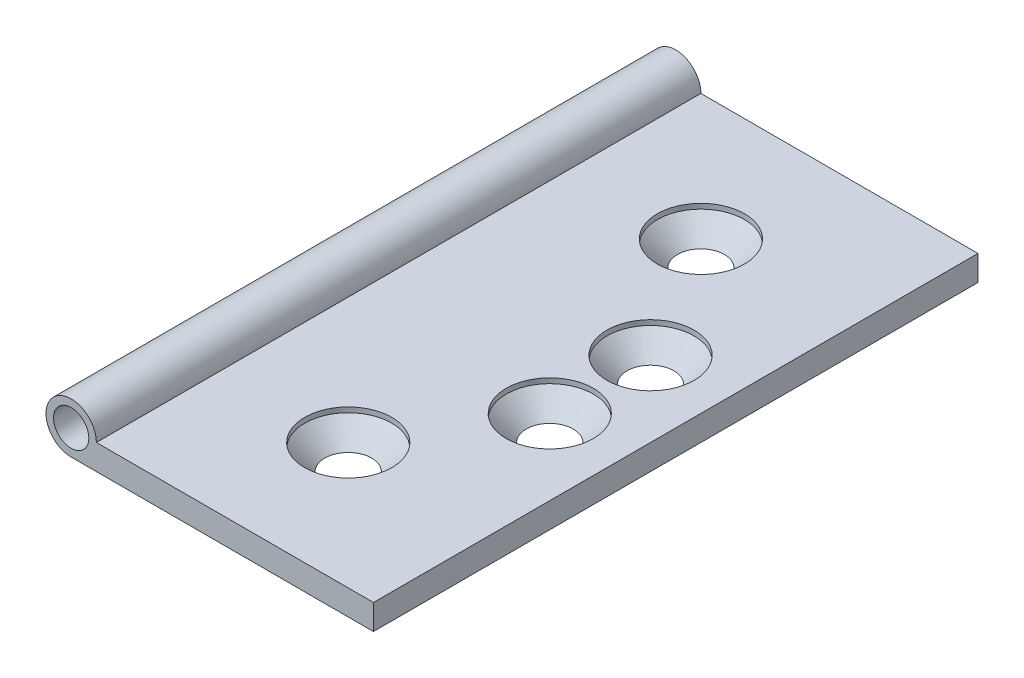
from build123d import *

# Parameters (mm, degrees)
SKETCH_1_W                 = 60
SKETCH_1_H                 = 5
EXTRUDE_1_DEPTH            = 60
SKETCH_3_R                 = 5
EXTRUDE_1_2_DEPTH          = 120
SKETCH_4_R                 = 3.5
CUT_EXTRUDE_1_DEPTH        = 120
HOLE_WIZARD_M81_AT_2_COUNT = 2
HOLE_WIZARD_M81_AT_2_PITCH = 29.154759474


with BuildPart() as part:
    # Эскиз1 → Extrude 1 (new, symmetric)
    with BuildSketch(Plane.XY):
        with Locations((30, -2.5)):
            Rectangle(SKETCH_1_W, SKETCH_1_H)
    extrude(amount=EXTRUDE_1_DEPTH, both=True)

    # Эскиз3 → Extrude 1 2 (add)
    with BuildSketch(Plane.XY.offset(60)):
        Circle(SKETCH_3_R)
    extrude(amount=-EXTRUDE_1_2_DEPTH)

    # Эскиз4 → Вырез-Вытянуть1 (cut)
    with BuildSketch(Plane.XY.offset(60)):
        Circle(SKETCH_4_R)
    extrude(amount=-CUT_EXTRUDE_1_DEPTH, mode=Mode.SUBTRACT)

    # Эскиз6 → Зенковка для  винта с полупотайной головкой M81 (revolve, cut)
    with BuildSketch(Plane(origin=(30, 0, 35), x_dir=(0, 0, 1), z_dir=(1, 0, 0))):
        Polygon((0, 0), (0, 5), (4.5, 5), (4.5, 5.15), (8.65, 1), (8.65, 0), align=None)
    hole_wizard_m81 = revolve(axis=Axis((30, 6.35, 35), (0, -1, 0)), mode=Mode.SUBTRACT)

    # Зенковка для  винта с полупотайной головкой M81 at 2: Зенковка для  винта с полупотайной головкой M81 ×2
    with Locations(*[Vector(0.5144957554275266, 0, -0.8574929257125442) * (i * HOLE_WIZARD_M81_AT_2_PITCH) for i in range(1, HOLE_WIZARD_M81_AT_2_COUNT)]):
        add(hole_wizard_m81, mode=Mode.SUBTRACT)

    # Зеркальное отражение2: Зенковка для  винта с полупотайной головкой M81 across plane
    add(hole_wizard_m81.mirror(Plane.XY), mode=Mode.SUBTRACT)

    # Зеркальное отражение2 copy 1 sketch → Зеркальное отражение2 copy 1 (revolve, cut)
    with BuildSketch(Plane(origin=(45, 0, -10), x_dir=(0, 0, -1), z_dir=(1, 0, 0))):
        Polygon((0, 0), (0, -5), (4.5, -5), (4.5, -5.15), (8.65, -1), (8.65, 0), align=None)
    revolve(axis=Axis((45, 6.35, -10), (0, 1, 0)), mode=Mode.SUBTRACT)


solid = part.part
